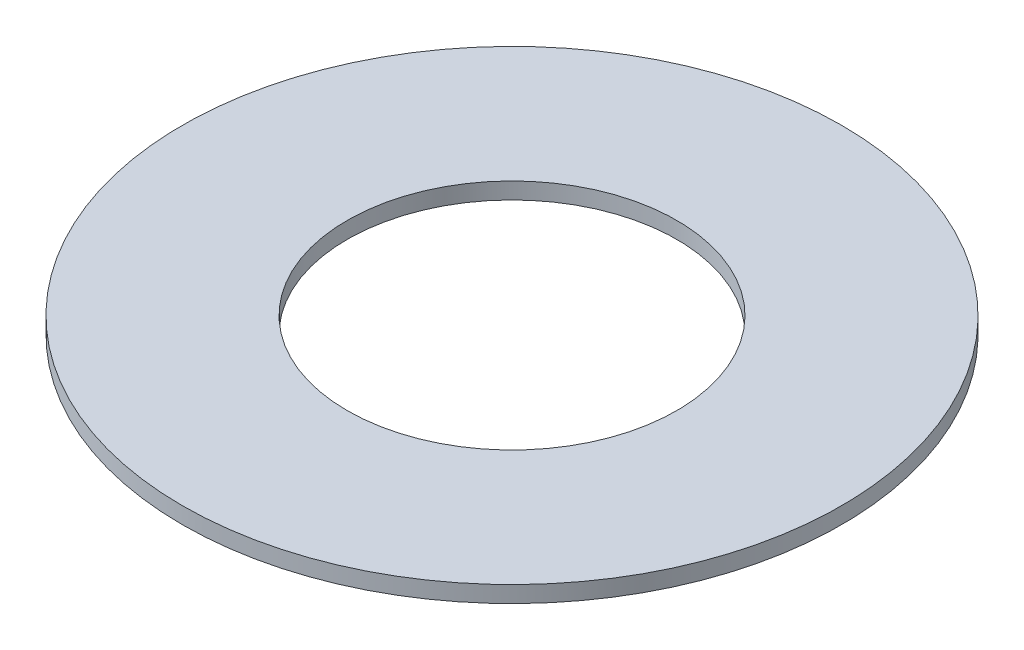
from build123d import *

# Parameters (mm, degrees)
SKETCH_1_R      = 2
SKETCH_1_R_2    = 1
EXTRUDE_1_DEPTH = 0.1


with BuildPart() as part:
    # 草图1 → 凸台-拉伸1 (new body)
    with BuildSketch(Plane(origin=(0, 0, 0), x_dir=(1, 0, 0), z_dir=(0, 1, 0))):
        with Locations(Location((0, 0, 0), (0, 0, 270))):
            Circle(SKETCH_1_R)
        with Locations(Location((0, 0, 0), (0, 0, 270))):
            Circle(SKETCH_1_R_2, mode=Mode.SUBTRACT)
    extrude(amount=EXTRUDE_1_DEPTH)


solid = part.part
